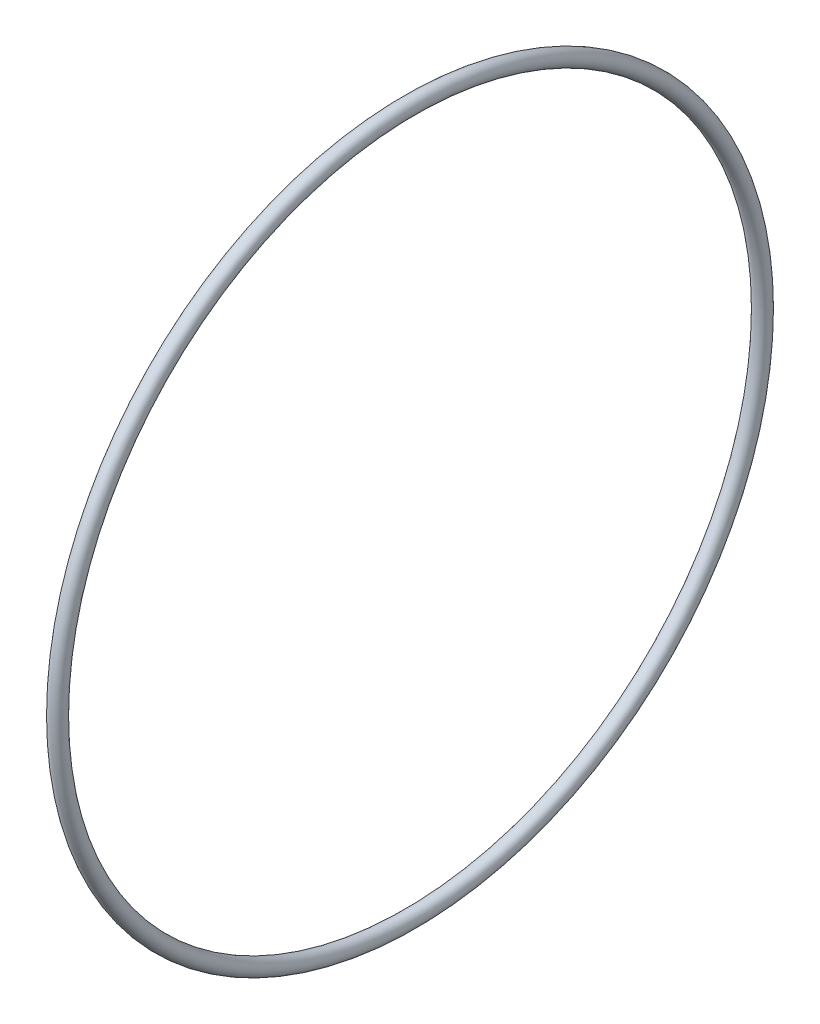
from build123d import *

# Parameters (mm, degrees)
SKETCH_1_R = 1.55


with BuildPart() as part:
    # ｽｹｯﾁ1 → Oリング (revolve)
    with BuildSketch(Plane.XY, mode=Mode.PRIVATE) as revolve_o_sk:
        with Locations((0, 70.05)):
            Circle(SKETCH_1_R)
    revolve(revolve_o_sk.sketch.rotate(Axis((0, 0, 0), (1, 0, 0)), 90), axis=Axis((0, 0, 0), (1, 0, 0)))


solid = part.part
